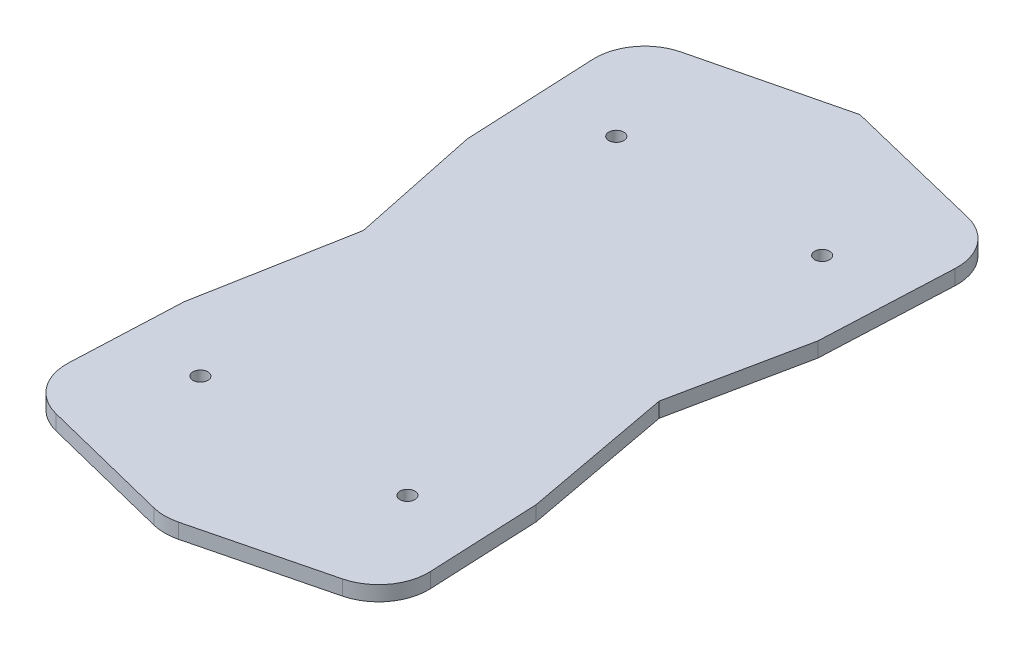
from build123d import *

# Parameters (mm, degrees)
CROQUIS1_R              = 1.5
SALIENTE_EXTRUIR1_DEPTH = 3


with BuildPart() as part:
    # Croquis1 → Saliente-Extruir1 (new body)
    with BuildSketch(Plane(origin=(0, 0, 0), x_dir=(1, 0, 0), z_dir=(0, 1, 0))):
        with BuildLine():
            Line((-35.322649353, -4.523785763), (-29.713798408, 25.866039525))
            Line((-29.713798408, 25.866039525), (-35.221795469, 52.273603799))
            Line((-35.221795469, 52.273603799), (-36.45117663, 78.681168073))
            ThreePointArc((-36.45117663, 78.681168073), (-34.470773885, 85.134483293), (-28.840989272, 88.859103754))
            Line((-28.840989272, 88.859103754), (0, 95.923167849))
            Line((0, 95.923167849), (28.745582144, 88.873347738))
            ThreePointArc((28.745582144, 88.873347738), (34.369430491, 85.153487685), (36.353462125, 78.709215227))
            Line((36.353462125, 78.709215227), (35.159044734, 52.307970662))
            Line((35.159044734, 52.307970662), (29.69822954, 25.906726097))
            Line((29.69822954, 25.906726097), (35.352965357, -4.492390106))
            Line((35.352965357, -4.492390106), (36.368027066, -26.718230301))
            ThreePointArc((36.368027066, -26.718230301), (34.398862632, -33.147130574), (28.803795931, -36.875883169))
            Line((28.803795931, -36.875883169), (2.42535625, -43.470493089))
            ThreePointArc((2.42535625, -43.470493089), (0, -43.769068087), (-2.42535625, -43.470493089))
            Line((-2.42535625, -43.470493089), (-28.730703822, -36.894156196))
            ThreePointArc((-28.730703822, -36.894156196), (-34.320110297, -33.172996946), (-36.295781209, -26.755426116))
            Line((-36.295781209, -26.755426116), (-35.322649353, -4.523785763))
        make_face()
        with Locations(Location((-20.692659667, 67.660143415, 0), (0, 0, 270))):
            Circle(CROQUIS1_R, mode=Mode.SUBTRACT)
        with Locations(Location((20.730030015, 67.612237294, 0), (0, 0, 270))):
            Circle(CROQUIS1_R, mode=Mode.SUBTRACT)
        with Locations(Location((-20.750709845, -15.848615277, 0), (0, 0, 270))):
            Circle(CROQUIS1_R, mode=Mode.SUBTRACT)
        with Locations(Location((20.809934934, -15.806357426, 0), (0, 0, 270))):
            Circle(CROQUIS1_R, mode=Mode.SUBTRACT)
    extrude(amount=SALIENTE_EXTRUIR1_DEPTH)


solid = part.part
